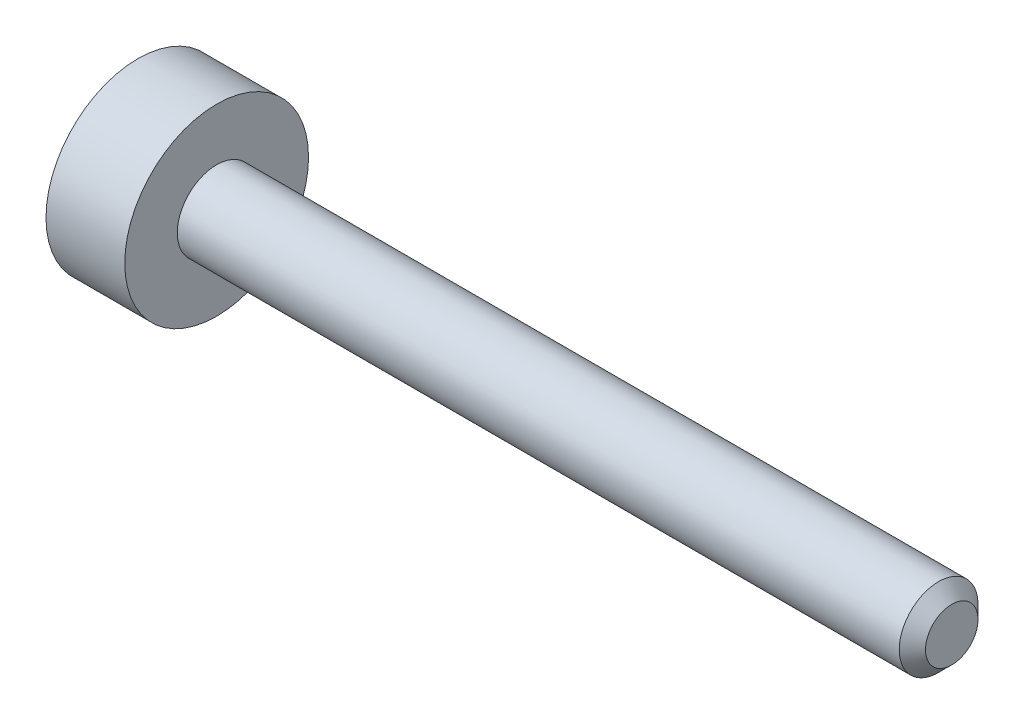
from build123d import *

# Parameters (mm, degrees)
CUT_EXTRUDE1_DEPTH = 1.5


with BuildPart() as part:
    # Sketch1 → Revolve1 (revolve)
    with BuildSketch(Plane.XY, mode=Mode.PRIVATE) as revolve1_sk:
        Polygon((0, 0), (0, 1), (-0.5, 1.5), (-28, 1.5), (-28, 3.5), (-31, 3.5), (-31, 0), align=None)
    revolve(revolve1_sk.sketch.rotate(Axis((0, 0, 0), (1, 0, 0)), 90), axis=Axis((0, 0, 0), (1, 0, 0)))

    # Sketch2 → Cut-Extrude1 (cut)
    with BuildSketch(Plane.ZY.offset(31)):
        Polygon((0, 1.732050808), (-1.5, 0.866025404), (-1.5, -0.866025404), (0, -1.732050808), (1.5, -0.866025404), (1.5, 0.866025404), align=None)
    extrude(amount=-CUT_EXTRUDE1_DEPTH, mode=Mode.SUBTRACT)


solid = part.part
